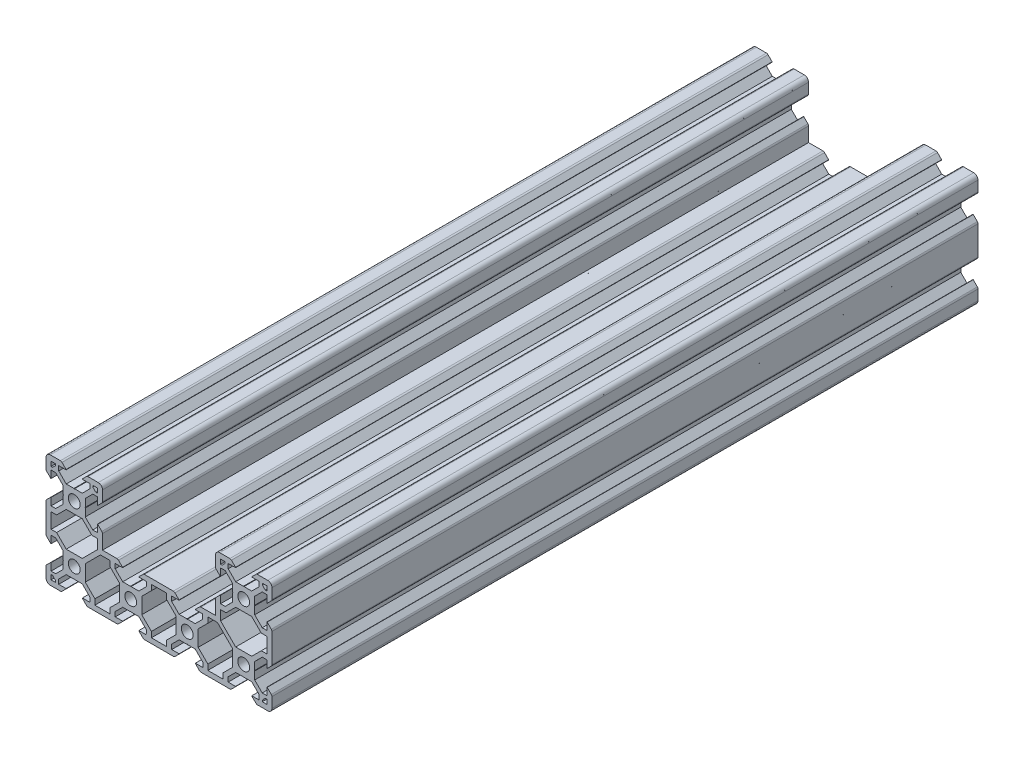
from build123d import *

# Parameters (mm, degrees)
SKETCH3_R           = 2.1
BOSS_EXTRUDE3_DEPTH = 250


with BuildPart() as part:
    # Sketch3 → Boss-Extrude3 (new body)
    with BuildSketch(Plane.XY):
        with BuildLine():
            Line((-8.2, 2.882517024), (-8.2, 5.495853945))
            Line((-8.2, 5.495853945), (-6.56, 5.495853945))
            Line((-6.56, 5.495853945), (-3.9, 2.836663079))
            Line((-3.9, 2.836663079), (-3.9, 0.09834827))
            Line((-3.9, 0.09834827), (-3.799157405, 0.00963488))
            Line((-3.799157405, 0.00963488), (-3.9, -0.103336921))
            Line((-3.9, -0.103336921), (-3.9, -2.84165173))
            Line((-3.9, -2.84165173), (-6.56, -5.496196366))
            Line((-6.56, -5.496196366), (-8.2, -5.496196366))
            Line((-8.2, -5.496196366), (-8.2, -2.882859445))
            Line((-8.2, -2.882859445), (-8.31, -2.882859445))
            Line((-8.31, -2.882859445), (-9.765685425, -4.33854487))
            ThreePointArc((-9.765685425, -4.33854487), (-9.939103626, -4.598083549), (-10, -4.904230295))
            Line((-10, -4.904230295), (-10, -15.093617801))
            ThreePointArc((-10, -15.093617801), (-9.939103626, -15.399764547), (-9.765685425, -15.659303226))
            Line((-9.765685425, -15.659303226), (-8.31, -17.114988651))
            Line((-8.31, -17.114988651), (-8.2, -17.114988651))
            Line((-8.2, -17.114988651), (-8.2, -14.50165173))
            Line((-8.2, -14.50165173), (-6.56, -14.50165173))
            Line((-6.56, -14.50165173), (-3.9, -17.168325571))
            Line((-3.9, -17.168325571), (-3.9, -19.906640381))
            Line((-3.9, -19.906640381), (-3.805222007, -20.001418373))
            Line((-3.805222007, -20.001418373), (-3.9, -20.096196366))
            Line((-3.9, -20.096196366), (-3.9, -22.834511176))
            Line((-3.9, -22.834511176), (-6.56, -25.493702041))
            Line((-6.56, -25.493702041), (-8.2, -25.493702041))
            Line((-8.2, -25.493702041), (-8.2, -22.88036512))
            Line((-8.2, -22.88036512), (-8.31, -22.88036512))
            Line((-8.31, -22.88036512), (-9.768614357, -24.338979477))
            ThreePointArc((-9.768614357, -24.338979477), (-9.939864831, -24.595273923), (-10, -24.897593834))
            Line((-10, -24.897593834), (-10, -28.49036512))
            ThreePointArc((-10, -28.49036512), (-9.560660172, -29.551025292), (-8.5, -29.99036512))
            Line((-8.5, -29.99036512), (-4.907228714, -29.99036512))
            ThreePointArc((-4.907228714, -29.99036512), (-4.597037815, -29.933069776), (-4.333990827, -29.758979477))
            Line((-4.333990827, -29.758979477), (-2.87537647, -28.30036512))
            Line((-2.87537647, -28.30036512), (-2.87537647, -28.19036512))
            Line((-2.87537647, -28.19036512), (-5.48871339, -28.19036512))
            Line((-5.48871339, -28.19036512), (-5.48871339, -26.551685287))
            Line((-5.48871339, -26.551685287), (-2.829078524, -23.892859445))
            Line((-2.829078524, -23.892859445), (-0.08871339, -23.892859445))
            Line((-0.08871339, -23.892859445), (0, -23.792859445))
            Line((0, -23.792859445), (0.08871339, -23.892859445))
            Line((0.08871339, -23.892859445), (2.829078524, -23.892859445))
            Line((2.829078524, -23.892859445), (5.503336921, -26.551280874))
            Line((5.503336921, -26.551280874), (5.503336921, -28.19036512))
            Line((5.503336921, -28.19036512), (2.89, -28.19036512))
            Line((2.89, -28.19036512), (2.89, -28.30036512))
            Line((2.89, -28.30036512), (4.345685425, -29.756050545))
            ThreePointArc((4.345685425, -29.756050545), (4.605224104, -29.929468746), (4.91137085, -29.99036512))
            Line((4.91137085, -29.99036512), (15.08862915, -29.99036512))
            ThreePointArc((15.08862915, -29.99036512), (15.394775896, -29.929468746), (15.654314575, -29.756050545))
            Line((15.654314575, -29.756050545), (17.11, -28.30036512))
            Line((17.11, -28.30036512), (17.11, -28.19036512))
            Line((17.11, -28.19036512), (14.496663079, -28.19036512))
            Line((14.496663079, -28.19036512), (14.496663079, -26.552454909))
            Line((14.496663079, -26.552454909), (17.170477537, -23.892859445))
            Line((17.170477537, -23.892859445), (19.910477537, -23.892859445))
            Line((19.910477537, -23.892859445), (20.010927049, -23.792944111))
            Line((20.010927049, -23.792944111), (20.110842384, -23.892859445))
            Line((20.110842384, -23.892859445), (22.849157193, -23.892859445))
            Line((22.849157193, -23.892859445), (25.51587163, -26.559573883))
            Line((25.51587163, -26.559573883), (25.48871339, -28.19036512))
            Line((25.48871339, -28.19036512), (22.87537647, -28.19036512))
            Line((22.87537647, -28.19036512), (22.87537647, -28.30036512))
            Line((22.87537647, -28.30036512), (24.331061895, -29.756050545))
            ThreePointArc((24.331061895, -29.756050545), (24.590600574, -29.929468746), (24.89674732, -29.99036512))
            Line((24.89674732, -29.99036512), (35.10325268, -29.99036512))
            ThreePointArc((35.10325268, -29.99036512), (35.409399426, -29.929468746), (35.668938105, -29.756050545))
            Line((35.668938105, -29.756050545), (37.12462353, -28.30036512))
            Line((37.12462353, -28.30036512), (37.12462353, -28.19036512))
            Line((37.12462353, -28.19036512), (34.51128661, -28.19036512))
            Line((34.51128661, -28.19036512), (34.48412837, -26.559573883))
            Line((34.48412837, -26.559573883), (37.150842807, -23.892859445))
            Line((37.150842807, -23.892859445), (39.889157616, -23.892859445))
            Line((39.889157616, -23.892859445), (39.989072951, -23.792944111))
            Line((39.989072951, -23.792944111), (40.089522463, -23.892859445))
            Line((40.089522463, -23.892859445), (42.829522463, -23.892859445))
            Line((42.829522463, -23.892859445), (45.503336921, -26.552454909))
            Line((45.503336921, -26.552454909), (45.503336921, -28.19036512))
            Line((45.503336921, -28.19036512), (42.89, -28.19036512))
            Line((42.89, -28.19036512), (42.89, -28.30036512))
            Line((42.89, -28.30036512), (44.345685425, -29.756050545))
            ThreePointArc((44.345685425, -29.756050545), (44.605224104, -29.929468746), (44.91137085, -29.99036512))
            Line((44.91137085, -29.99036512), (55.08862915, -29.99036512))
            ThreePointArc((55.08862915, -29.99036512), (55.394775896, -29.929468746), (55.654314575, -29.756050545))
            Line((55.654314575, -29.756050545), (57.11, -28.30036512))
            Line((57.11, -28.30036512), (57.11, -28.19036512))
            Line((57.11, -28.19036512), (54.496663079, -28.19036512))
            Line((54.496663079, -28.19036512), (54.496663079, -26.551280874))
            Line((54.496663079, -26.551280874), (57.170921476, -23.892859445))
            Line((57.170921476, -23.892859445), (59.91128661, -23.892859445))
            Line((59.91128661, -23.892859445), (60, -23.792859445))
            Line((60, -23.792859445), (60.08871339, -23.892859445))
            Line((60.08871339, -23.892859445), (62.829078524, -23.892859445))
            Line((62.829078524, -23.892859445), (65.48871339, -26.551685287))
            Line((65.48871339, -26.551685287), (65.48871339, -28.19036512))
            Line((65.48871339, -28.19036512), (62.87537647, -28.19036512))
            Line((62.87537647, -28.19036512), (62.87537647, -28.30036512))
            Line((62.87537647, -28.30036512), (64.333990827, -29.758979477))
            ThreePointArc((64.333990827, -29.758979477), (64.597037815, -29.933069776), (64.907228714, -29.99036512))
            Line((64.907228714, -29.99036512), (68.5, -29.99036512))
            ThreePointArc((68.5, -29.99036512), (69.560660172, -29.551025292), (70, -28.49036512))
            Line((70, -28.49036512), (70, -24.897593834))
            ThreePointArc((70, -24.897593834), (69.939864831, -24.595273923), (69.768614357, -24.338979477))
            Line((69.768614357, -24.338979477), (68.31, -22.88036512))
            Line((68.31, -22.88036512), (68.2, -22.88036512))
            Line((68.2, -22.88036512), (68.2, -25.493702041))
            Line((68.2, -25.493702041), (66.56, -25.493702041))
            Line((66.56, -25.493702041), (63.9, -22.834511176))
            Line((63.9, -22.834511176), (63.9, -20.096196366))
            Line((63.9, -20.096196366), (63.805222007, -20.001418373))
            Line((63.805222007, -20.001418373), (63.9, -19.906640381))
            Line((63.9, -19.906640381), (63.9, -17.168325571))
            Line((63.9, -17.168325571), (66.56, -14.50165173))
            Line((66.56, -14.50165173), (68.2, -14.50165173))
            Line((68.2, -14.50165173), (68.2, -17.114988651))
            Line((68.2, -17.114988651), (68.31, -17.114988651))
            Line((68.31, -17.114988651), (69.765685425, -15.659303226))
            ThreePointArc((69.765685425, -15.659303226), (69.939103626, -15.399764547), (70, -15.093617801))
            Line((70, -15.093617801), (70, -4.904230295))
            ThreePointArc((70, -4.904230295), (69.939103626, -4.598083549), (69.765685425, -4.33854487))
            Line((69.765685425, -4.33854487), (68.31, -2.882859445))
            Line((68.31, -2.882859445), (68.2, -2.882859445))
            Line((68.2, -2.882859445), (68.2, -5.496196366))
            Line((68.2, -5.496196366), (66.56, -5.496196366))
            Line((66.56, -5.496196366), (63.9, -2.84165173))
            Line((63.9, -2.84165173), (63.9, -0.103336921))
            Line((63.9, -0.103336921), (63.799157405, 0.00963488))
            Line((63.799157405, 0.00963488), (63.9, 0.09834827))
            Line((63.9, 0.09834827), (63.9, 2.836663079))
            Line((63.9, 2.836663079), (66.56, 5.495853945))
            Line((66.56, 5.495853945), (68.2, 5.495853945))
            Line((68.2, 5.495853945), (68.2, 2.882517024))
            Line((68.2, 2.882517024), (68.31, 2.882517024))
            Line((68.31, 2.882517024), (69.768614357, 4.341131381))
            ThreePointArc((69.768614357, 4.341131381), (69.939864831, 4.597425827), (70, 4.899745738))
            Line((70, 4.899745738), (70, 8.505591811))
            ThreePointArc((70, 8.505591811), (69.559475984, 9.569110864), (68.495956932, 10.00963488))
            Line((68.495956932, 10.00963488), (64.899916949, 10.00963488))
            ThreePointArc((64.899916949, 10.00963488), (64.597597038, 9.949499711), (64.341302592, 9.778249237))
            Line((64.341302592, 9.778249237), (62.882688235, 8.31963488))
            Line((62.882688235, 8.31963488), (62.882688235, 8.20798315))
            Line((62.882688235, 8.20798315), (65.496025155, 8.20798315))
            Line((65.496025155, 8.20798315), (65.496025155, 6.565966397))
            Line((65.496025155, 6.565966397), (62.835002123, 3.907140555))
            Line((62.835002123, 3.907140555), (60.106673841, 3.907140555))
            Line((60.106673841, 3.907140555), (60, 3.807140555))
            Line((60, 3.807140555), (59.893326159, 3.907140555))
            Line((59.893326159, 3.907140555), (57.164997877, 3.907140555))
            Line((57.164997877, 3.907140555), (54.503974845, 6.565966397))
            Line((54.503974845, 6.565966397), (54.503974845, 8.20798315))
            Line((54.503974845, 8.20798315), (57.117311765, 8.20798315))
            Line((57.117311765, 8.20798315), (57.117311765, 8.31963488))
            Line((57.117311765, 8.31963488), (55.658697408, 9.778249237))
            ThreePointArc((55.658697408, 9.778249237), (55.402402962, 9.949499711), (55.100083051, 10.00963488))
            Line((55.100083051, 10.00963488), (51.504043068, 10.00963488))
            ThreePointArc((51.504043068, 10.00963488), (50.440524016, 9.569110864), (50, 8.505591811))
            Line((50, 8.505591811), (50, 4.899745738))
            ThreePointArc((50, 4.899745738), (50.060135169, 4.597425827), (50.231385643, 4.341131381))
            Line((50.231385643, 4.341131381), (51.69, 2.882517024))
            Line((51.69, 2.882517024), (51.8, 2.882517024))
            Line((51.8, 2.882517024), (51.8, 5.495853945))
            Line((51.8, 5.495853945), (53.44, 5.495853945))
            Line((53.44, 5.495853945), (56.1, 2.836663079))
            Line((56.1, 2.836663079), (56.1, 0.09834827))
            Line((56.1, 0.09834827), (56.200842595, 0.00963488))
            Line((56.200842595, 0.00963488), (56.1, -0.103336921))
            Line((56.1, -0.103336921), (56.1, -2.84165173))
            Line((56.1, -2.84165173), (53.44, -5.496196366))
            Line((53.44, -5.496196366), (51.8, -5.496196366))
            Line((51.8, -5.496196366), (51.8, -2.882859445))
            Line((51.8, -2.882859445), (51.69, -2.882859445))
            Line((51.69, -2.882859445), (50.234314575, -4.33854487))
            ThreePointArc((50.234314575, -4.33854487), (50.060896374, -4.598083549), (50, -4.904230295))
            Line((50, -4.904230295), (50, -9.99036512))
            Line((50, -9.99036512), (44.898067602, -9.99036512))
            ThreePointArc((44.898067602, -9.99036512), (44.591343398, -10.053565048), (44.332382177, -10.229670286))
            Line((44.332382177, -10.229670286), (42.876696752, -11.685355711))
            Line((42.876696752, -11.685355711), (42.876696752, -11.789524465))
            Line((42.876696752, -11.789524465), (45.490033672, -11.789524465))
            Line((45.490033672, -11.789524465), (45.490033672, -13.429929001))
            Line((45.490033672, -13.429929001), (42.830438209, -16.089524465))
            Line((42.830438209, -16.089524465), (40.090438209, -16.089524465))
            Line((40.090438209, -16.089524465), (39.990255786, -16.189706888))
            Line((39.990255786, -16.189706888), (39.890073362, -16.089524465))
            Line((39.890073362, -16.089524465), (37.151758553, -16.089524465))
            Line((37.151758553, -16.089524465), (34.492163089, -13.429929001))
            Line((34.492163089, -13.429929001), (34.497983423, -11.79036512))
            Line((34.497983423, -11.79036512), (37.111320344, -11.79036512))
            Line((37.111320344, -11.79036512), (37.111320344, -11.68036512))
            Line((37.111320344, -11.68036512), (35.655634919, -10.224679695))
            ThreePointArc((35.655634919, -10.224679695), (35.39609624, -10.051261494), (35.089949494, -9.99036512))
            Line((35.089949494, -9.99036512), (24.910050506, -9.99036512))
            ThreePointArc((24.910050506, -9.99036512), (24.60390376, -10.051261494), (24.344365081, -10.224679695))
            Line((24.344365081, -10.224679695), (22.888679656, -11.68036512))
            Line((22.888679656, -11.68036512), (22.888679656, -11.79036512))
            Line((22.888679656, -11.79036512), (25.502016577, -11.79036512))
            Line((25.502016577, -11.79036512), (25.507836911, -13.429929001))
            Line((25.507836911, -13.429929001), (22.848241447, -16.089524465))
            Line((22.848241447, -16.089524465), (20.109926638, -16.089524465))
            Line((20.109926638, -16.089524465), (20.009744214, -16.189706888))
            Line((20.009744214, -16.189706888), (19.909561791, -16.089524465))
            Line((19.909561791, -16.089524465), (17.169561791, -16.089524465))
            Line((17.169561791, -16.089524465), (14.509966328, -13.429929001))
            Line((14.509966328, -13.429929001), (14.509966328, -11.789524465))
            Line((14.509966328, -11.789524465), (17.123303248, -11.789524465))
            Line((17.123303248, -11.789524465), (17.123303248, -11.685355711))
            Line((17.123303248, -11.685355711), (15.667617823, -10.229670286))
            ThreePointArc((15.667617823, -10.229670286), (15.408656602, -10.053565048), (15.101932398, -9.99036512))
            Line((15.101932398, -9.99036512), (10, -9.99036512))
            Line((10, -9.99036512), (10, -4.904230295))
            ThreePointArc((10, -4.904230295), (9.939103626, -4.598083549), (9.765685425, -4.33854487))
            Line((9.765685425, -4.33854487), (8.31, -2.882859445))
            Line((8.31, -2.882859445), (8.2, -2.882859445))
            Line((8.2, -2.882859445), (8.2, -5.496196366))
            Line((8.2, -5.496196366), (6.56, -5.496196366))
            Line((6.56, -5.496196366), (3.9, -2.84165173))
            Line((3.9, -2.84165173), (3.9, -0.103336921))
            Line((3.9, -0.103336921), (3.799157405, 0.00963488))
            Line((3.799157405, 0.00963488), (3.9, 0.09834827))
            Line((3.9, 0.09834827), (3.9, 2.836663079))
            Line((3.9, 2.836663079), (6.56, 5.495853945))
            Line((6.56, 5.495853945), (8.2, 5.495853945))
            Line((8.2, 5.495853945), (8.2, 2.882517024))
            Line((8.2, 2.882517024), (8.31, 2.882517024))
            Line((8.31, 2.882517024), (9.768614357, 4.341131381))
            ThreePointArc((9.768614357, 4.341131381), (9.939864831, 4.597425827), (10, 4.899745738))
            Line((10, 4.899745738), (10, 8.505591811))
            ThreePointArc((10, 8.505591811), (9.559475984, 9.569110864), (8.495956932, 10.00963488))
            Line((8.495956932, 10.00963488), (4.899916949, 10.00963488))
            ThreePointArc((4.899916949, 10.00963488), (4.597597038, 9.949499711), (4.341302592, 9.778249237))
            Line((4.341302592, 9.778249237), (2.882688235, 8.31963488))
            Line((2.882688235, 8.31963488), (2.882688235, 8.20798315))
            Line((2.882688235, 8.20798315), (5.496025155, 8.20798315))
            Line((5.496025155, 8.20798315), (5.496025155, 6.565966397))
            Line((5.496025155, 6.565966397), (2.835002123, 3.907140555))
            Line((2.835002123, 3.907140555), (0.106673841, 3.907140555))
            Line((0.106673841, 3.907140555), (0, 3.807140555))
            Line((0, 3.807140555), (-0.106673841, 3.907140555))
            Line((-0.106673841, 3.907140555), (-2.835002123, 3.907140555))
            Line((-2.835002123, 3.907140555), (-5.496025155, 6.565966397))
            Line((-5.496025155, 6.565966397), (-5.496025155, 8.20798315))
            Line((-5.496025155, 8.20798315), (-2.882688235, 8.20798315))
            Line((-2.882688235, 8.20798315), (-2.882688235, 8.31963488))
            Line((-2.882688235, 8.31963488), (-4.341302592, 9.778249237))
            ThreePointArc((-4.341302592, 9.778249237), (-4.597597038, 9.949499711), (-4.899916949, 10.00963488))
            Line((-4.899916949, 10.00963488), (-8.495956932, 10.00963488))
            ThreePointArc((-8.495956932, 10.00963488), (-9.559475984, 9.569110864), (-10, 8.505591811))
            Line((-10, 8.505591811), (-10, 4.899745738))
            ThreePointArc((-10, 4.899745738), (-9.939864831, 4.597425827), (-9.768614357, 4.341131381))
            Line((-9.768614357, 4.341131381), (-8.31, 2.882517024))
            Line((-8.31, 2.882517024), (-8.2, 2.882517024))
        make_face()
        with Locations((0, 0.00963488)):
            Circle(SKETCH3_R, mode=Mode.SUBTRACT)
        with Locations((0, -19.99036512)):
            Circle(SKETCH3_R, mode=Mode.SUBTRACT)
        with Locations((20, -19.99036512)):
            Circle(SKETCH3_R, mode=Mode.SUBTRACT)
        with Locations(Location((40, -19.99036512, 0), (0, 0, 180))):
            Circle(SKETCH3_R, mode=Mode.SUBTRACT)
        with Locations(Location((60, -19.99036512, 0), (0, 0, 180))):
            Circle(SKETCH3_R, mode=Mode.SUBTRACT)
        with Locations(Location((60, 0.00963488, 0), (0, 0, 180))):
            Circle(SKETCH3_R, mode=Mode.SUBTRACT)
        Polygon((-6.57, 8.20798315), (-6.57, 7.66798315), (-7.66, 6.57798315), (-8.2, 6.57798315), (-8.2, 8.20798315), align=None, mode=Mode.SUBTRACT)
        Polygon((-8.2, -7.297745508), (-6.238124911, -7.297745508), (-2.835002123, -3.901602147), (0, -3.901602147), (2.835002123, -3.901602147), (6.238124911, -7.297745508), (8.2, -7.297745508), (8.2, -10.729522525), (2.84, -16.089522525), (0, -16.089522525), (-2.840365134, -16.089522525), (-6.24, -12.689887659), (-8.2, -12.689887659), align=None, mode=Mode.SUBTRACT)
        Polygon((-6.57, -28.19036512), (-8.2, -28.19036512), (-8.2, -26.56036512), (-7.66, -26.56036512), (-6.57, -27.65036512), align=None, mode=Mode.SUBTRACT)
        Polygon((53.43, 8.20798315), (53.43, 7.66798315), (52.34, 6.57798315), (51.8, 6.57798315), (51.8, 8.20798315), align=None, mode=Mode.SUBTRACT)
        Polygon((27.319269746, -13.75036512), (23.909634866, -17.16), (23.909634866, -22.82073024), (27.319269746, -26.23036512), (27.319269746, -28.19036512), (32.680730254, -28.19036512), (32.680730254, -26.23036512), (36.090365134, -22.82073024), (36.090365134, -17.16), (32.680730254, -13.75036512), (32.680730254, -11.79036512), (27.319269746, -11.79036512), align=None, mode=Mode.SUBTRACT)
        Polygon((7.30963488, -26.243108892), (7.30963488, -28.19036512), (12.699999986, -28.19036512), (12.699999986, -26.24036512), (16.109634866, -22.83073024), (16.109634866, -17.159999986), (12.699999986, -13.750365106), (12.699999986, -11.798690691), (9.26963488, -11.798690691), (3.9, -17.168325571), (3.9, -22.834511176), align=None, mode=Mode.SUBTRACT)
        Polygon((51.8, -7.297745508), (53.761875089, -7.297745508), (57.164997877, -3.901602147), (60, -3.901602147), (62.835002123, -3.901602147), (66.238124911, -7.297745508), (68.2, -7.297745508), (68.2, -12.689887659), (66.24, -12.689887659), (62.840365134, -16.089522525), (60, -16.089522525), (57.16, -16.089522525), (51.8, -10.729522525), align=None, mode=Mode.SUBTRACT)
        Polygon((56.1, -17.168325571), (50.73036512, -11.798690691), (47.300000014, -11.798690691), (47.300000014, -13.750365106), (43.890365134, -17.159999986), (43.890365134, -22.83073024), (47.300000014, -26.24036512), (47.300000014, -28.19036512), (52.69036512, -28.19036512), (52.69036512, -26.243108892), (56.1, -22.834511176), align=None, mode=Mode.SUBTRACT)
        Polygon((66.57, -28.19036512), (66.57, -27.65036512), (67.66, -26.56036512), (68.2, -26.56036512), (68.2, -28.19036512), align=None, mode=Mode.SUBTRACT)
        Polygon((66.57, 8.20798315), (68.2, 8.20798315), (68.2, 6.57798315), (67.66, 6.57798315), (66.57, 7.66798315), align=None, mode=Mode.SUBTRACT)
        Polygon((6.57, 8.20798315), (8.2, 8.20798315), (8.2, 6.57798315), (7.66, 6.57798315), (6.57, 7.66798315), align=None, mode=Mode.SUBTRACT)
    extrude(amount=BOSS_EXTRUDE3_DEPTH)


solid = part.part
